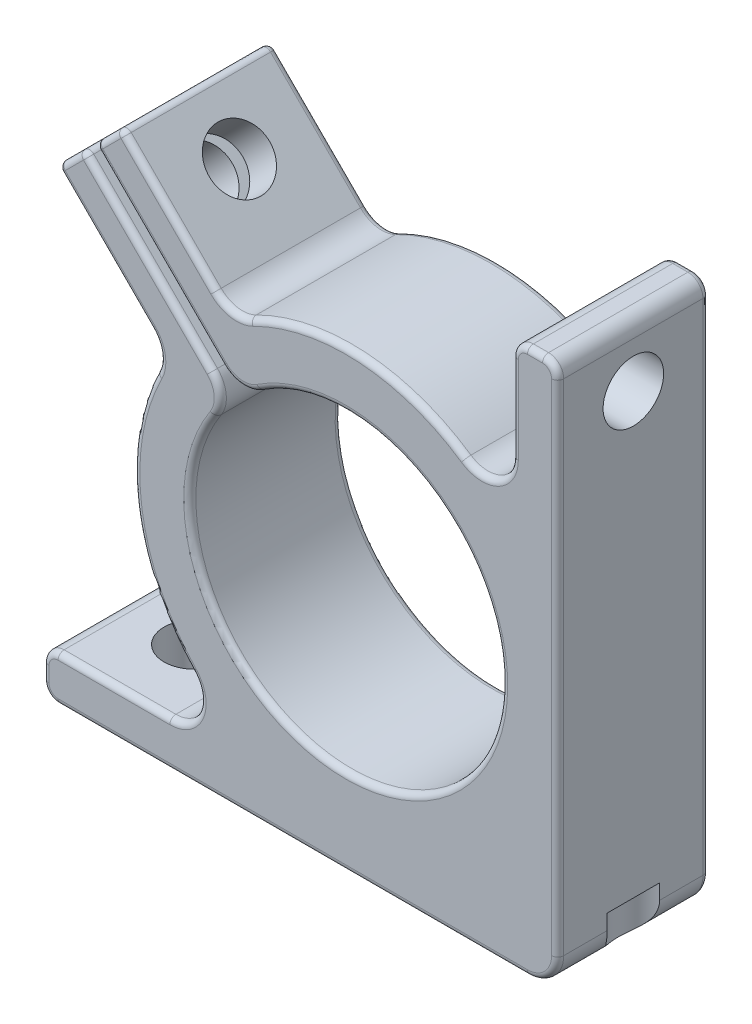
from build123d import *

# Parameters (mm, degrees)
EXTRUDE_1_DEPTH     = 5
CUT_EXTRUDE_1_REACH = 21.931
SKETCH_3_R          = 1
FILLET_2_R          = 0.2
CUT_EXTRUDE_2_REACH = 21.112
SKETCH_4_R          = 1
SKETCH_5_R          = 1
CUT_EXTRUDE_3_DEPTH = 10


with BuildPart() as part:
    # 草图1 → 凸台-拉伸1 (new body)
    with BuildSketch(Plane.XY):
        with BuildLine():
            Line((-9.5, -6.5), (-5.809475019, -6.5))
            ThreePointArc((-5.809475019, -6.5), (-4.890916366, -5.895284708), (-5.083290642, -4.8125))
            ThreePointArc((-5.083290642, -4.8125), (-6.926305331, -1.013061924), (-6.24864911, 3.155056942))
            ThreePointArc((-6.24864911, 3.155056942), (-6.153913207, 3.764023225), (-6.434206487, 4.312886143))
            Line((-6.434206487, 4.312886143), (-9.40452019, 7.283199846))
            ThreePointArc((-9.40452019, 7.283199846), (-9.463098834, 7.424621202), (-9.40452019, 7.566042559))
            Line((-9.40452019, 7.566042559), (-8.803479426, 8.167083323))
            ThreePointArc((-8.803479426, 8.167083323), (-8.66205807, 8.225661966), (-8.520636713, 8.167083323))
            Line((-8.520636713, 8.167083323), (-4.434710467, 4.081157076))
            ThreePointArc((-4.434710467, 4.081157076), (-4.147049322, 3.476210822), (-4.305749403, 2.825424231))
            ThreePointArc((-4.305749403, 2.825424231), (3.641599923, -3.641599923), (-2.825424231, 4.305749403))
            ThreePointArc((-2.825424231, 4.305749403), (-3.476210822, 4.147049322), (-4.081157076, 4.434710467))
            Line((-4.081157076, 4.434710467), (-8.167083323, 8.520636713))
            ThreePointArc((-8.167083323, 8.520636713), (-8.225661966, 8.66205807), (-8.167083323, 8.803479426))
            Line((-8.167083323, 8.803479426), (-7.566042559, 9.40452019))
            ThreePointArc((-7.566042559, 9.40452019), (-7.424621202, 9.463098834), (-7.283199846, 9.40452019))
            Line((-7.283199846, 9.40452019), (-4.312886143, 6.434206487))
            ThreePointArc((-4.312886143, 6.434206487), (-3.764023225, 6.153913207), (-3.155056942, 6.24864911))
            ThreePointArc((-3.155056942, 6.24864911), (0.454092762, 6.985255884), (3.9375, 5.787580993))
            ThreePointArc((3.9375, 5.787580993), (4.967707173, 5.730494801), (5.5, 6.614378278))
            Line((5.5, 6.614378278), (5.5, 9.5))
            ThreePointArc((5.5, 9.5), (5.646446609, 9.853553391), (6, 10))
            Line((6, 10), (6.5, 10))
            ThreePointArc((6.5, 10), (6.853553391, 9.853553391), (7, 9.5))
            Line((7, 9.5), (7, -7))
            ThreePointArc((7, -7), (6.707106781, -7.707106781), (6, -8))
            Line((6, -8), (-9.5, -8))
            ThreePointArc((-9.5, -8), (-9.853553391, -7.853553391), (-10, -7.5))
            Line((-10, -7.5), (-10, -7))
            ThreePointArc((-10, -7), (-9.853553391, -6.646446609), (-9.5, -6.5))
        make_face()
    extrude(amount=EXTRUDE_1_DEPTH)

    # 草图3 → 切除-拉伸1 (cut, up to next)
    with BuildSketch(Plane(origin=(0, -6.5, 0), x_dir=(1, 0, 0), z_dir=(0, 1, 0)), mode=Mode.PRIVATE) as cut_extrude_1_sk1:
        with Locations(Location((-7.5, -2.5, 0), (0, 0, 270))):
            Circle(SKETCH_3_R)
    cut_extrude_1_tool1 = extrude(cut_extrude_1_sk1.sketch, amount=-CUT_EXTRUDE_1_REACH, mode=Mode.PRIVATE) & part.part
    # 草图3 → 切除-拉伸1 (cut, up to next)
    with BuildSketch(Plane(origin=(0, -6.5, 0), x_dir=(1, 0, 0), z_dir=(0, 1, 0)), mode=Mode.PRIVATE) as cut_extrude_1_sk2:
        with Locations((7.5, -2.5)):
            Circle(SKETCH_3_R)
    cut_extrude_1_tool2 = extrude(cut_extrude_1_sk2.sketch, amount=-CUT_EXTRUDE_1_REACH, mode=Mode.PRIVATE) & part.part
    add(cut_extrude_1_tool1.solids().sort_by_distance((-7.5, -6.5, 2.5))[0], mode=Mode.SUBTRACT)
    add(cut_extrude_1_tool2.solids().sort_by_distance((7.5, -6.5, 2.5))[0], mode=Mode.SUBTRACT)

    # 圆角2
    fillet_2_edges = [part.edges().sort_by_distance(p)[0] for p in [
        (6.853553391, 9.853553391, 5),
        (6.25, 10, 5),
        (5.646446609, 9.853553391, 5),
        (5.5, 8.057189139, 5),
        (4.967707173, 5.730494801, 5),
        (0.454092762, 6.985255884, 5),
        (-1.75, -8, 0),
        (-9.853553391, -7.853553391, 0),
        (-10, -7.25, 0),
        (-9.853553391, -6.646446609, 0),
        (-7.65473751, -6.5, 0),
        (-4.890916366, -5.895284708, 0),
        (-6.926305331, -1.013061924, 0),
        (-3.764023225, 6.153913207, 5),
        (-6.153913207, 3.764023225, 0),
        (-7.919363338, 5.798042995, 0),
        (-9.463098834, 7.424621202, 0),
        (-9.103999808, 7.866562941, 0),
        (-8.66205807, 8.225661966, 0),
        (-6.47767359, 6.124120199, 0),
        (-4.147049322, 3.476210822, 0),
        (3.641599923, -3.641599923, 0),
        (-5.798042995, 7.919363338, 5),
        (-3.476210822, 4.147049322, 0),
        (-6.124120199, 6.47767359, 0),
        (-8.225661966, 8.66205807, 0),
        (-7.866562941, 9.103999808, 0),
        (-7.424621202, 9.463098834, 0),
        (-5.798042995, 7.919363338, 0),
        (-3.764023225, 6.153913207, 0),
        (-7.424621202, 9.463098834, 5),
        (0.454092762, 6.985255884, 0),
        (4.967707173, 5.730494801, 0),
        (5.5, 8.057189139, 0),
        (5.646446609, 9.853553391, 0),
        (6.25, 10, 0),
        (6.853553391, 9.853553391, 0),
        (7, 1.25, 0),
        (6.707106781, -7.707106781, 0),
        (-7.866562941, 9.103999808, 5),
        (6.707106781, -7.707106781, 5),
        (-8.225661966, 8.66205807, 5),
        (-6.124120199, 6.47767359, 5),
        (-3.476210822, 4.147049322, 5),
        (3.641599923, -3.641599923, 5),
        (-4.147049322, 3.476210822, 5),
        (-6.47767359, 6.124120199, 5),
        (-8.66205807, 8.225661966, 5),
        (-9.103999808, 7.866562941, 5),
        (-9.463098834, 7.424621202, 5),
        (-7.919363338, 5.798042995, 5),
        (7, 1.25, 5),
        (-6.153913207, 3.764023225, 5),
        (-6.926305331, -1.013061924, 5),
        (-4.890916366, -5.895284708, 5),
        (-7.65473751, -6.5, 5),
        (-9.853553391, -6.646446609, 5),
        (-10, -7.25, 5),
        (-9.853553391, -7.853553391, 5),
        (-1.75, -8, 5),
    ]]
    fillet(fillet_2_edges, radius=FILLET_2_R)

    # 草图4 → 切除-拉伸2 (cut, up to next)
    with BuildSketch(Plane.ZY.offset(-5.5), mode=Mode.PRIVATE) as cut_extrude_2_sk1:
        with Locations(Location((2.5, 8, 0), (0, 0, 270))):
            Circle(SKETCH_4_R)
    cut_extrude_2_tool1 = extrude(cut_extrude_2_sk1.sketch, amount=-CUT_EXTRUDE_2_REACH, mode=Mode.PRIVATE) & part.part
    add(cut_extrude_2_tool1.solids().sort_by_distance((5.5, 8, 2.5))[0], mode=Mode.SUBTRACT)

    # 草图5 → 切除-拉伸3 (cut)
    with BuildSketch(Plane(origin=(-1.060660172, -1.060660172, 0), x_dir=(0, 0, 1), z_dir=(-0.7071067811865477, -0.7071067811865475, 0))):
        with Locations(Location((2.5, 10, 0), (0, 0, 270))):
            Circle(SKETCH_5_R)
    extrude(amount=-CUT_EXTRUDE_3_DEPTH, mode=Mode.SUBTRACT)


solid = part.part
